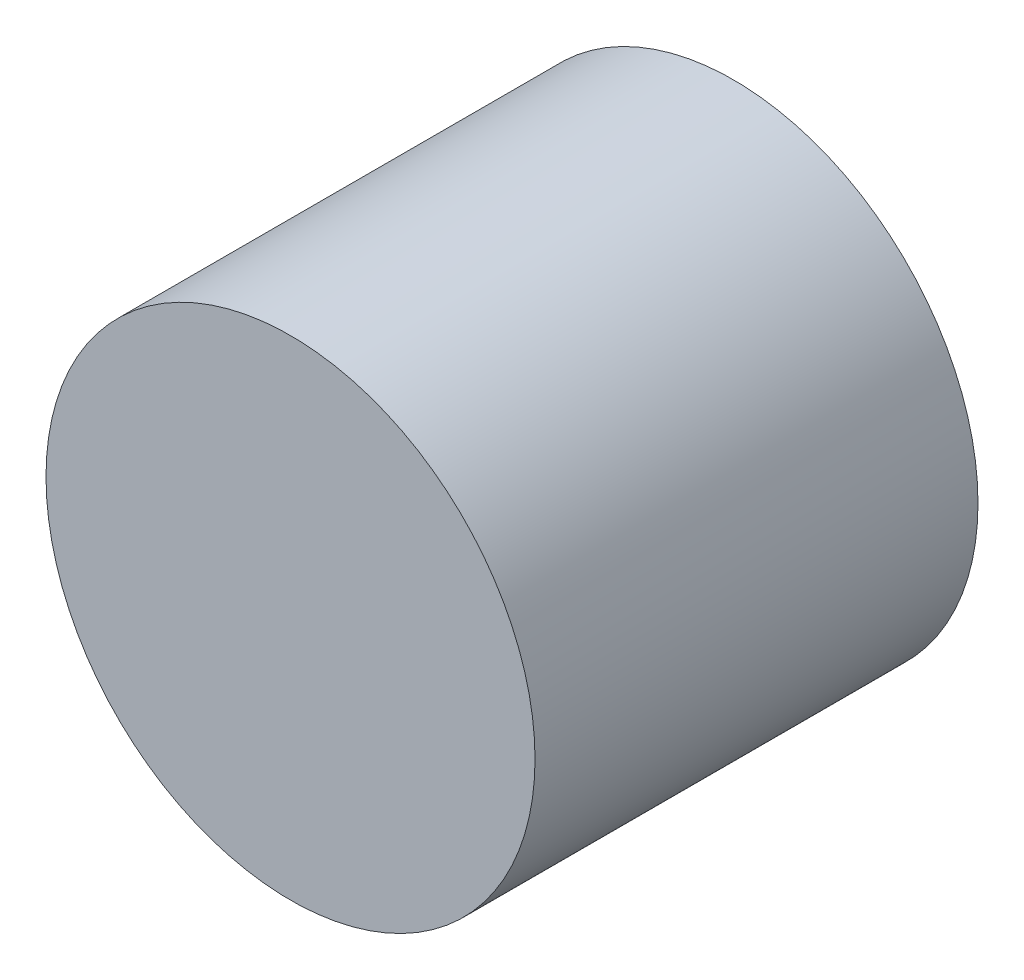
from build123d import *

# Parameters (mm, degrees)
SKETCH1_R           = 13.8
BOSS_EXTRUDE1_DEPTH = 25


with BuildPart() as part:
    # Sketch1 → Boss-Extrude1 (new body)
    with BuildSketch(Plane.XY):
        Circle(SKETCH1_R)
    extrude(amount=BOSS_EXTRUDE1_DEPTH)


solid = part.part
